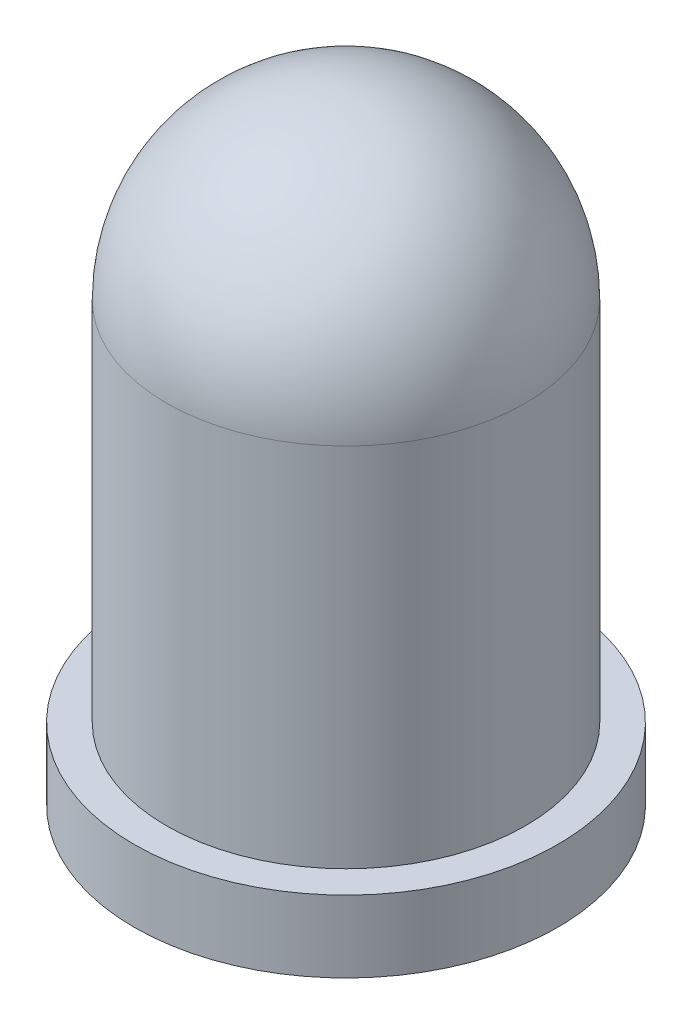
from build123d import *


with BuildPart() as part:
    # Sketch1 → Revolve2 (revolve)
    with BuildSketch(Plane(origin=(0, 0, 0), x_dir=(0, 0, -1), z_dir=(1, 0, 0)), mode=Mode.PRIVATE) as revolve2_sk:
        with BuildLine():
            Line((2.5, 1), (2.95, 1))
            Line((2.95, 1), (2.95, 0))
            Line((2.95, 0), (0, 0))
            Line((0, 0), (0, 8.6))
            ThreePointArc((0, 8.6), (1.767766953, 7.867766953), (2.5, 6.1))
            Line((2.5, 6.1), (2.5, 1))
        make_face()
    revolve(revolve2_sk.sketch.rotate(Axis((0, 8.6, 0), (0, -1, 0)), 180), axis=Axis((0, 8.6, 0), (0, -1, 0)))


solid = part.part
